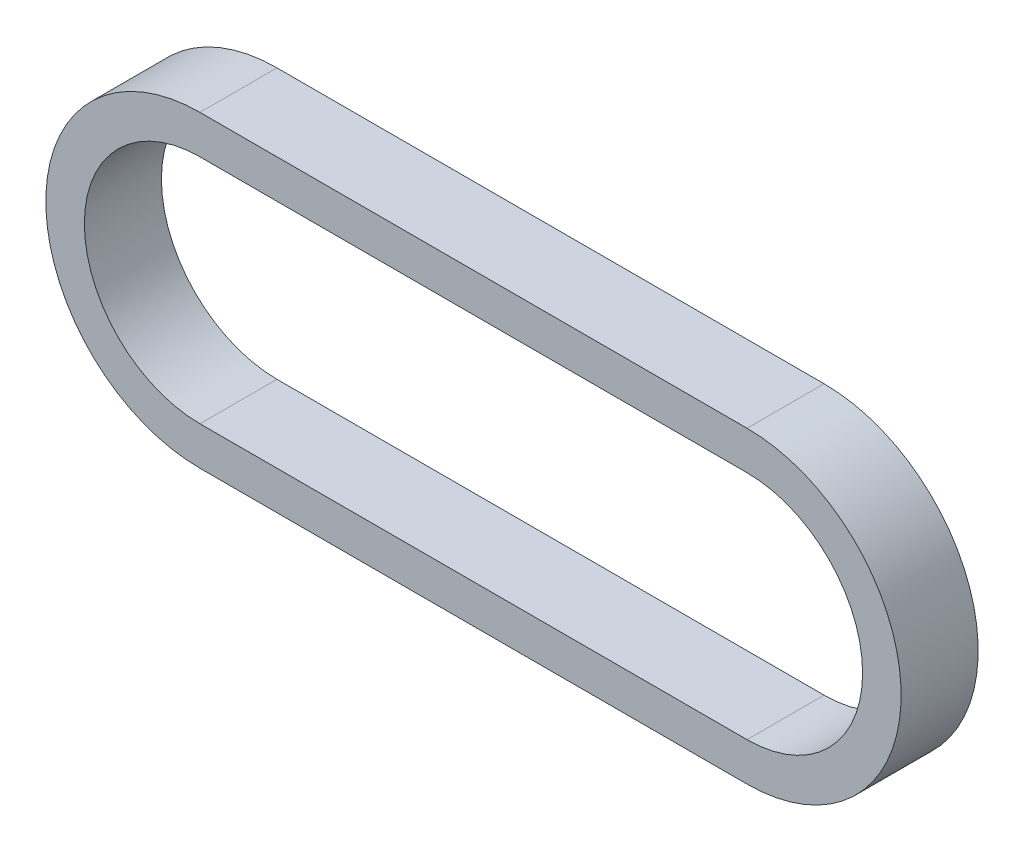
from build123d import *

# Parameters (mm, degrees)
EXTRUDE_1_DEPTH = 10


with BuildPart() as part:
    # ｽｹｯﾁ1 → ﾎﾞｽ - 押し出し1 (new body)
    with BuildSketch(Plane.XY):
        with BuildLine():
            Line((0, 20), (71, 20))
            ThreePointArc((71, 20), (91, 0), (71, -20))
            Line((71, -20), (0, -20))
            ThreePointArc((0, -20), (-20, 0), (0, 20))
        make_face()
        with BuildLine():
            Line((0, 15), (71, 15))
            ThreePointArc((71, 15), (86, 0), (71, -15))
            Line((71, -15), (0, -15))
            ThreePointArc((0, -15), (-15, 0), (0, 15))
        make_face(mode=Mode.SUBTRACT)
    extrude(amount=EXTRUDE_1_DEPTH)


solid = part.part
